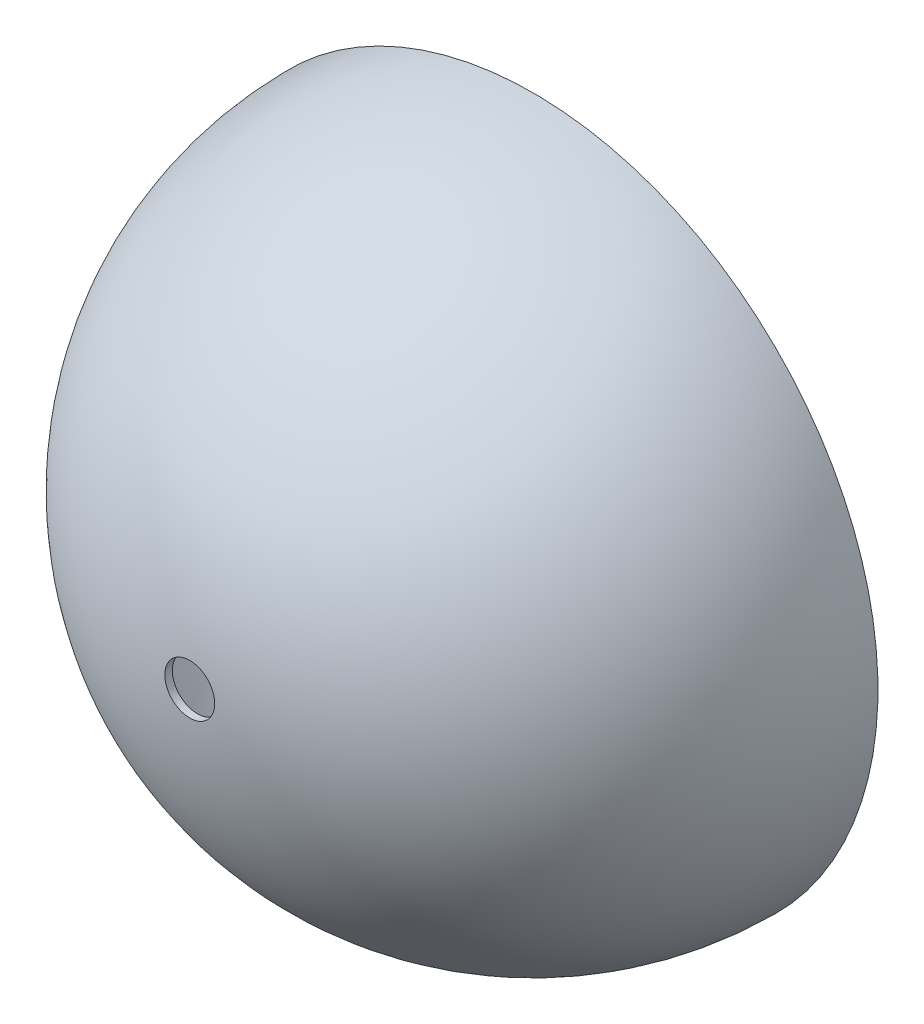
from build123d import *

# Parameters (mm, degrees)
REVOLVE1_ANGLE          = 180
CUT_EXTRUDE5_DEPTH      = 1196.115057223
CUT_EXTRUDE5_DEPTH_BACK = 1196.115057223
SKETCH2_R               = 50


with BuildPart() as part:
    # Sketch1 → Revolve1 (revolve)
    with BuildSketch(Plane.XY):
        with BuildLine():
            Line((0, 690), (0, 675))
            ThreePointArc((0, 675), (675, 0), (0, -675))
            Line((0, -675), (0, -690))
            ThreePointArc((0, -690), (690, 0), (0, 690))
        make_face()
    revolve(axis=Axis((0, -675, 0), (0, -1, 0)), revolution_arc=REVOLVE1_ANGLE)

    # Sketch2 → Cut-Extrude5 (cut, two sides: drawn at the far end of the back side and taken through both)
    with BuildSketch(Plane.XY.offset(-CUT_EXTRUDE5_DEPTH_BACK)):
        Circle(SKETCH2_R)
    extrude(amount=CUT_EXTRUDE5_DEPTH + CUT_EXTRUDE5_DEPTH_BACK, mode=Mode.SUBTRACT)


solid = part.part
